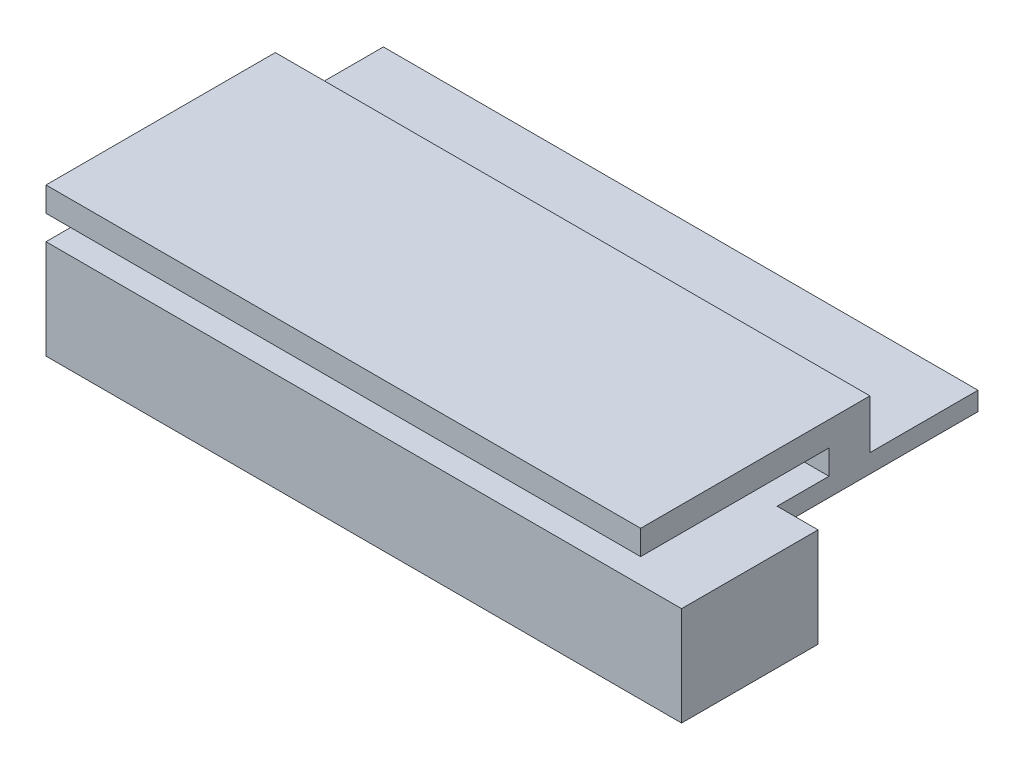
from build123d import *

# Parameters (mm, degrees)
SKETCH1_W           = 3
SKETCH1_H           = 21.71695
SKETCH1_W_2         = 2.8
SKETCH1_H_2         = 4
SKETCH1_W_3         = 0.2
BOSS_EXTRUDE3_DEPTH = 1.36
BOSS_EXTRUDE4_START = -1.36
SKETCH1_7_W         = 3
SKETCH1_7_H         = 21.71695
SKETCH1_7_W_2       = 2.8
SKETCH1_7_H_2       = 4
SKETCH1_7_W_3       = 0.2
BOSS_EXTRUDE4_DEPTH = 2.2
BOSS_EXTRUDE5_START = -3.56
SKETCH1_8_W         = 3
SKETCH1_8_H         = 21.71695
BOSS_EXTRUDE5_DEPTH = 1.7
BOSS_EXTRUDE6_START = -5.26
SKETCH1_9_W         = 3
SKETCH1_9_H         = 21.71695
SKETCH1_9_W_2       = 2.8
SKETCH1_9_H_2       = 4
SKETCH1_9_W_3       = 0.2
BOSS_EXTRUDE6_DEPTH = 2
SKETCH2_W           = 43.56375
SKETCH2_H           = 3
BOSS_EXTRUDE7_DEPTH = 1.8
BOSS_EXTRUDE8_START = 1.8
SKETCH2_3_W         = 43.56375
SKETCH2_3_H         = 3
BOSS_EXTRUDE8_DEPTH = 1.8


with BuildPart() as part:
    # Sketch1 → Boss-Extrude3 (new body)
    with BuildSketch(Plane(origin=(0, 0, 0), x_dir=(1, 0, 0), z_dir=(0, 1, 0))):
        Polygon((2.8, -21.51695), (-0.2, -21.51695), (-3.2, -21.51695), (-3.2, -24.51695), (40.36375, -24.51695), (40.36375, -21.51695), align=None)
        with Locations((-1.7, -10.658475)):
            Rectangle(SKETCH1_W, SKETCH1_H)
        Polygon((0, 0), (0, -21.31695), (2.8, -21.31695), (2.8, -18.51695), (2.8, 0), align=None)
        Polygon((40.16375, 0), (2.8, 0), (2.8, -18.51695), (37.36375, -18.51695), (37.36375, -14.51695), (40.16375, -14.51695), align=None)
        Polygon((2.8, -18.51695), (2.8, -21.31695), (40.16375, -21.31695), (40.16375, -18.51695), (37.36375, -18.51695), align=None)
        with Locations((38.76375, -16.51695)):
            Rectangle(SKETCH1_W_2, SKETCH1_H_2)
        Polygon((43.36375, -14.51695), (40.36375, -14.51695), (40.36375, -18.51695), (40.36375, -21.51695), (40.36375, -24.51695), (43.36375, -24.51695), align=None)
        Polygon((2.8, -21.31695), (2.8, -21.51695), (40.36375, -21.51695), (40.36375, -18.51695), (40.16375, -18.51695), (40.16375, -21.31695), align=None)
        Polygon((40.36375, 0.2), (2.8, 0.2), (2.8, 0), (40.16375, 0), (40.16375, -14.51695), (40.36375, -14.51695), align=None)
        with Locations((40.26375, -16.51695)):
            Rectangle(SKETCH1_W_3, SKETCH1_H_2)
        Polygon((0, -21.31695), (-0.2, -21.31695), (-0.2, -21.51695), (2.8, -21.51695), (2.8, -21.31695), align=None)
        Polygon((2.8, 0.2), (-0.2, 0.2), (-0.2, -21.31695), (0, -21.31695), (0, 0), (2.8, 0), align=None)
    extrude(amount=-BOSS_EXTRUDE3_DEPTH)

    # Sketch1<7> → Boss-Extrude4 (add)
    with BuildSketch(Plane(origin=(0, 0, 0), x_dir=(1, 0, 0), z_dir=(0, 1, 0)).offset(BOSS_EXTRUDE4_START)):
        Polygon((0, 0), (0, -21.31695), (2.8, -21.31695), (2.8, -18.51695), (2.8, 0), align=None)
        with Locations((-1.7, -10.658475)):
            Rectangle(SKETCH1_7_W, SKETCH1_7_H)
        Polygon((2.8, 0.2), (-0.2, 0.2), (-0.2, -21.31695), (0, -21.31695), (0, 0), (2.8, 0), align=None)
        Polygon((0, -21.31695), (-0.2, -21.31695), (-0.2, -21.51695), (2.8, -21.51695), (2.8, -21.31695), align=None)
        Polygon((2.8, -21.51695), (-0.2, -21.51695), (-3.2, -21.51695), (-3.2, -24.51695), (40.36375, -24.51695), (40.36375, -21.51695), align=None)
        Polygon((2.8, -21.31695), (2.8, -21.51695), (40.36375, -21.51695), (40.36375, -18.51695), (40.16375, -18.51695), (40.16375, -21.31695), align=None)
        Polygon((2.8, -18.51695), (2.8, -21.31695), (40.16375, -21.31695), (40.16375, -18.51695), (37.36375, -18.51695), align=None)
        with Locations((38.76375, -16.51695)):
            Rectangle(SKETCH1_7_W_2, SKETCH1_7_H_2)
        Polygon((43.36375, -14.51695), (40.36375, -14.51695), (40.36375, -18.51695), (40.36375, -21.51695), (40.36375, -24.51695), (43.36375, -24.51695), align=None)
        with Locations((40.26375, -16.51695)):
            Rectangle(SKETCH1_7_W_3, SKETCH1_7_H_2)
    extrude(amount=-BOSS_EXTRUDE4_DEPTH)

    # Sketch1<8> → Boss-Extrude5 (add)
    with BuildSketch(Plane(origin=(0, 0, 0), x_dir=(1, 0, 0), z_dir=(0, 1, 0)).offset(BOSS_EXTRUDE5_START)):
        with Locations((-1.7, -10.658475)):
            Rectangle(SKETCH1_8_W, SKETCH1_8_H)
        Polygon((2.8, -21.51695), (-0.2, -21.51695), (-3.2, -21.51695), (-3.2, -24.51695), (40.36375, -24.51695), (40.36375, -21.51695), align=None)
        Polygon((43.36375, -14.51695), (40.36375, -14.51695), (40.36375, -18.51695), (40.36375, -21.51695), (40.36375, -24.51695), (43.36375, -24.51695), align=None)
    extrude(amount=-BOSS_EXTRUDE5_DEPTH)

    # Sketch1<9> → Boss-Extrude6 (add)
    with BuildSketch(Plane(origin=(0, 0, 0), x_dir=(1, 0, 0), z_dir=(0, 1, 0)).offset(BOSS_EXTRUDE6_START)):
        with Locations((-1.7, -10.658475)):
            Rectangle(SKETCH1_9_W, SKETCH1_9_H)
        Polygon((0, 0), (0, -21.31695), (2.8, -21.31695), (2.8, -18.51695), (2.8, 0), align=None)
        Polygon((2.8, -21.51695), (-0.2, -21.51695), (-3.2, -21.51695), (-3.2, -24.51695), (40.36375, -24.51695), (40.36375, -21.51695), align=None)
        Polygon((2.8, -18.51695), (2.8, -21.31695), (40.16375, -21.31695), (40.16375, -18.51695), (37.36375, -18.51695), align=None)
        Polygon((43.36375, -14.51695), (40.36375, -14.51695), (40.36375, -18.51695), (40.36375, -21.51695), (40.36375, -24.51695), (43.36375, -24.51695), align=None)
        with Locations((38.76375, -16.51695)):
            Rectangle(SKETCH1_9_W_2, SKETCH1_9_H_2)
        Polygon((2.8, -21.31695), (2.8, -21.51695), (40.36375, -21.51695), (40.36375, -18.51695), (40.16375, -18.51695), (40.16375, -21.31695), align=None)
        with Locations((40.26375, -16.51695)):
            Rectangle(SKETCH1_9_W_3, SKETCH1_9_H_2)
        Polygon((0, -21.31695), (-0.2, -21.31695), (-0.2, -21.51695), (2.8, -21.51695), (2.8, -21.31695), align=None)
        Polygon((2.8, 0.2), (-0.2, 0.2), (-0.2, -21.31695), (0, -21.31695), (0, 0), (2.8, 0), align=None)
    extrude(amount=-BOSS_EXTRUDE6_DEPTH)

    # Sketch2 → Boss-Extrude7 (add)
    with BuildSketch(Plane(origin=(0, 0, 0), x_dir=(1, 0, 0), z_dir=(0, 1, 0))):
        with Locations((18.581875, -9.21695)):
            Rectangle(SKETCH2_W, SKETCH2_H)
    extrude(amount=BOSS_EXTRUDE7_DEPTH)

    # Sketch2<3> → Boss-Extrude8 (add)
    with BuildSketch(Plane(origin=(0, 0, 0), x_dir=(1, 0, 0), z_dir=(0, 1, 0)).offset(BOSS_EXTRUDE8_START)):
        Polygon((40.36375, -10.71695), (-3.2, -10.71695), (-3.2, -24.51695), (40.36375, -24.51695), (40.36375, -14.51695), align=None)
        with Locations((18.581875, -9.21695)):
            Rectangle(SKETCH2_3_W, SKETCH2_3_H)
    extrude(amount=BOSS_EXTRUDE8_DEPTH)


solid = part.part
